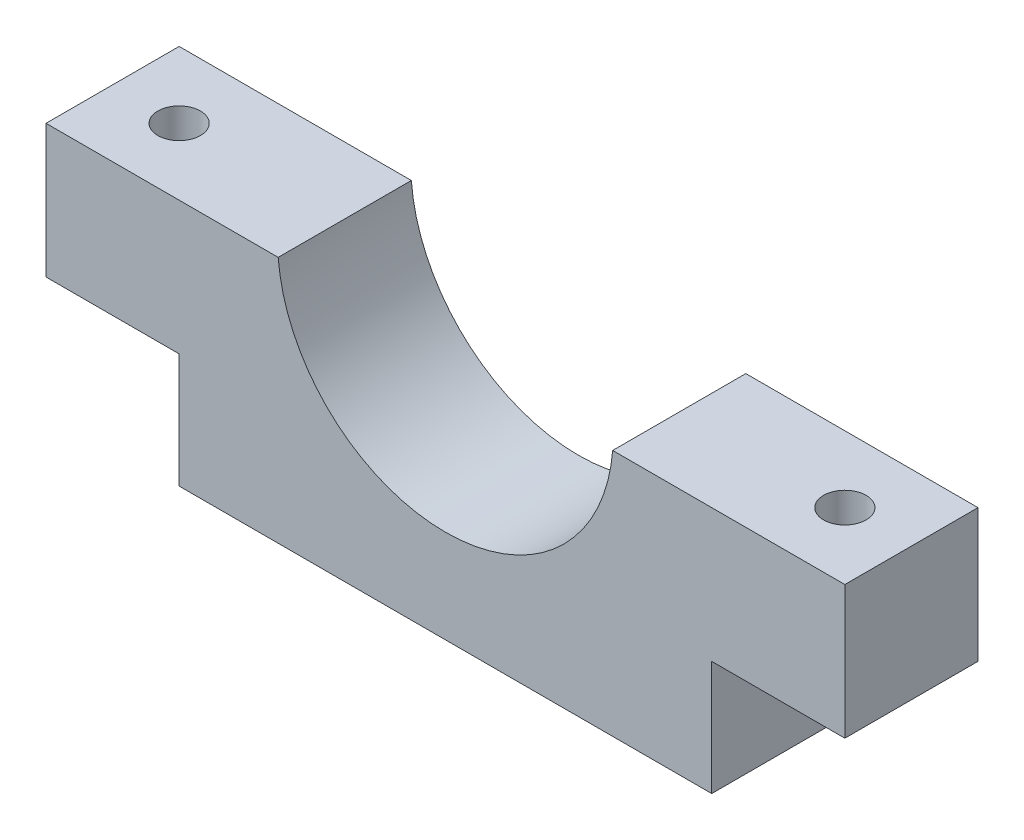
from build123d import *

# Parameters (mm, degrees)
SKETCH_1_W          = 10
SKETCH_1_H          = 10
EXTRUDE_1_DEPTH     = 10
SKETCH_2_R          = 1.6
CUT_EXTRUDE_1_DEPTH = 10


with BuildPart() as part:
    # Эскиз1 → Бобышка-Вытянуть1 (new body)
    with BuildSketch(Plane.XY):
        with Locations((-25, 4.3)):
            Rectangle(SKETCH_1_W, SKETCH_1_H)
        with BuildLine():
            ThreePointArc((-12.560254774, 9.3), (0, -2.3), (12.560254774, 9.3))
            Line((12.560254774, 9.3), (20, 9.3))
            Line((20, 9.3), (20, -9.3))
            Line((20, -9.3), (-20, -9.3))
            Line((-20, -9.3), (-20, 9.3))
            Line((-20, 9.3), (-12.560254774, 9.3))
        make_face()
        with Locations((25, 4.3)):
            Rectangle(SKETCH_1_W, SKETCH_1_H)
    extrude(amount=EXTRUDE_1_DEPTH)

    # Эскиз2 → Вырез-Вытянуть1 (cut)
    with BuildSketch(Plane(origin=(0, 9.3, 0), x_dir=(1, 0, 0), z_dir=(0, 1, 0))):
        with Locations(Location((25, -5, 0), (0, 0, 270))):
            Circle(SKETCH_2_R)
        with Locations(Location((-25, -5, 0), (0, 0, 90))):
            Circle(SKETCH_2_R)
    extrude(amount=-CUT_EXTRUDE_1_DEPTH, mode=Mode.SUBTRACT)


solid = part.part
